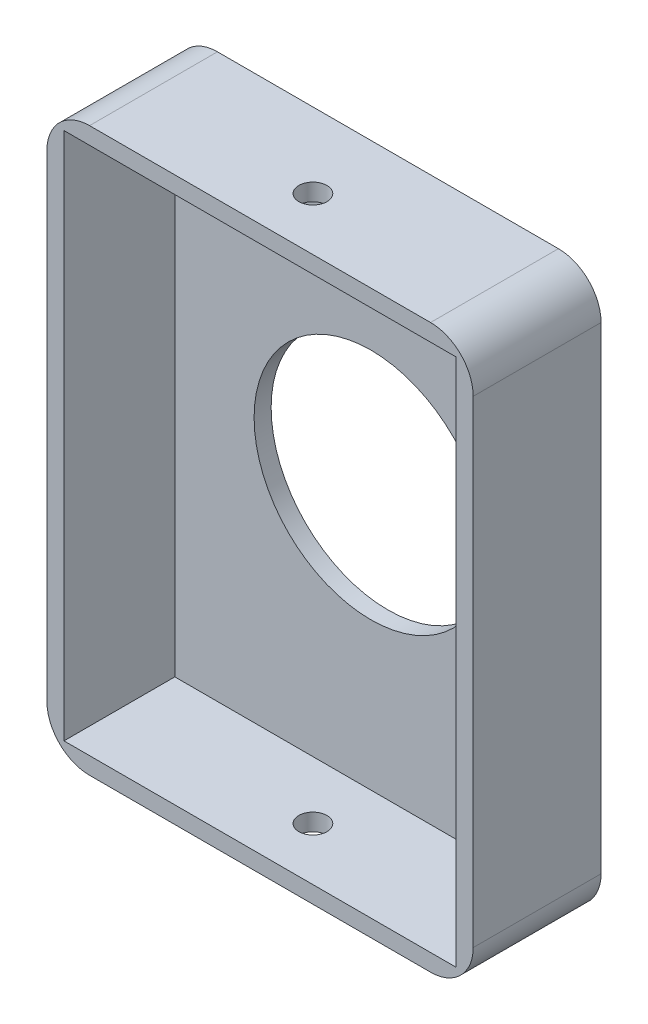
from build123d import *

# Parameters (mm, degrees)
SKETCH1_W               = 63.5
SKETCH1_H               = 83.82
BOSS_EXTRUDE1_DEPTH     = 19.05
SHELL1_T                = -2.54
CUT_EXTRUDE1_REACH      = 57.11
SKETCH2_R               = 17.399
FILLET4_R               = 6.35
CUT_EXTRUDE2_DEPTH      = 92.633822358
CUT_EXTRUDE2_DEPTH_BACK = 92.633822358
SKETCH3_R               = 2.0955


with BuildPart() as part:
    # Sketch1 → Boss-Extrude1 (new body)
    with BuildSketch(Plane.XY):
        Rectangle(SKETCH1_W, SKETCH1_H)
    extrude(amount=BOSS_EXTRUDE1_DEPTH)

    # Shell1
    shell1_openings = [part.faces().sort_by_distance(p)[0] for p in [
        (0, 0, 19.05),
    ]]
    offset(amount=SHELL1_T, openings=shell1_openings, kind=Kind.INTERSECTION)

    # Sketch2 → Cut-Extrude1 (cut, up to next)
    with BuildSketch(Plane.XY.offset(2.54), mode=Mode.PRIVATE) as cut_extrude1_sk1:
        Circle(SKETCH2_R)
    cut_extrude1_tool1 = extrude(cut_extrude1_sk1.sketch, amount=-CUT_EXTRUDE1_REACH, mode=Mode.PRIVATE) & part.part
    add(cut_extrude1_tool1.solids().sort_by_distance((0, 0, 2.54))[0], mode=Mode.SUBTRACT)

    # Fillet4
    fillet4_edges = [part.edges().sort_by_distance(p)[0] for p in [
        (31.75, -41.91, 9.525),
        (-31.75, -41.91, 9.525),
        (-31.75, 41.91, 9.525),
        (31.75, 41.91, 9.525),
    ]]
    fillet(fillet4_edges, radius=FILLET4_R)

    # Sketch3 → Cut-Extrude2 (cut, two sides: drawn at the far end of the back side and taken through both)
    with BuildSketch(Plane(origin=(0, 41.91, 0), x_dir=(1, 0, 0), z_dir=(0, 1, 0)).offset(-CUT_EXTRUDE2_DEPTH_BACK)):
        with Locations(Location((0, -11.176, 0), (0, 0, 270))):
            Circle(SKETCH3_R)
    extrude(amount=CUT_EXTRUDE2_DEPTH + CUT_EXTRUDE2_DEPTH_BACK, mode=Mode.SUBTRACT)


solid = part.part
